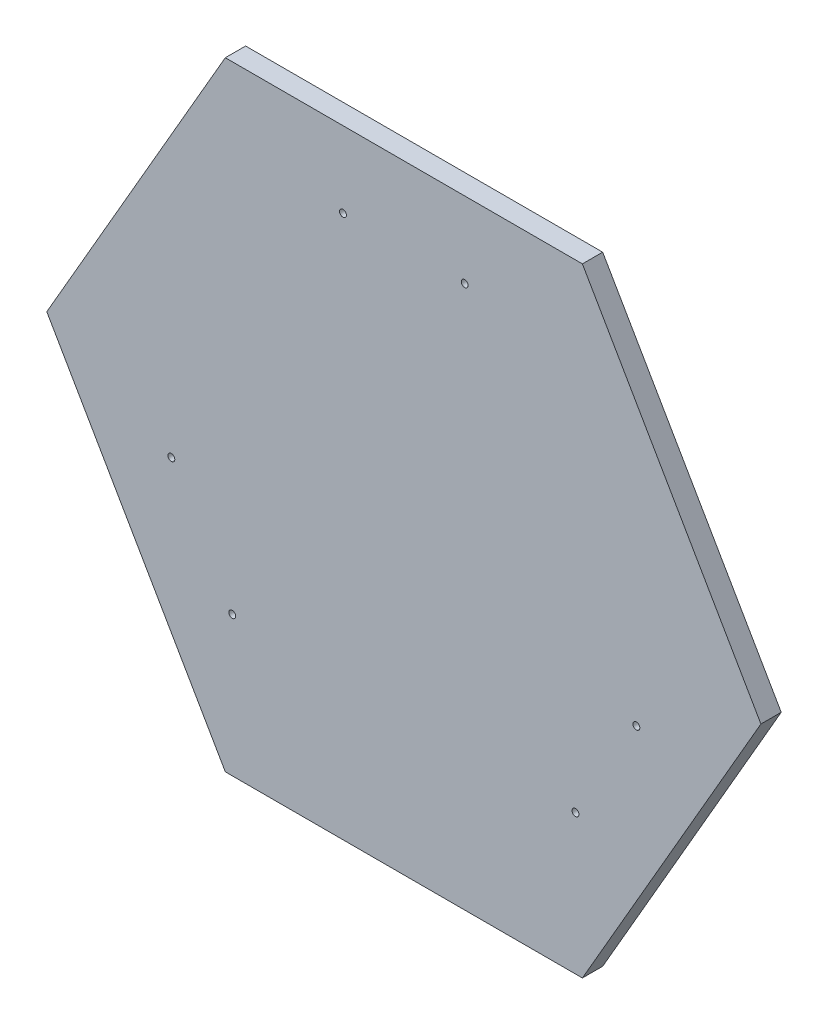
from build123d import *

# Parameters (mm, degrees)
BOSS_EXTRUDE1_DEPTH  = 5
M3_CLEARANCE_HOLE1_D = 3.4
CIRPATTERN1_COUNT    = 3


with BuildPart() as part:
    # Sketch2 → Boss-Extrude1 (new, symmetric)
    with BuildSketch(Plane.XY):
        Polygon((-87.988181024, 152.4), (-175.976362049, 0), (-87.988181024, -152.4), (87.988181024, -152.4), (175.976362049, 0), (87.988181024, 152.4), align=None)
    extrude(amount=BOSS_EXTRUDE1_DEPTH, both=True)

    # M3 Clearance Hole1 (through all)
    with Locations(Plane.XY.offset(5)):
        with Locations((-30.000000001, 115), (30.000000001, 115)):
            m3_clearance_hole1 = Hole(M3_CLEARANCE_HOLE1_D / 2)

    # CirPattern1: M3 Clearance Hole1 ×3 about axis
    cirpattern1_axis = Axis((0, 0, -20.250000596), (0, 0, 1))
    for i in range(1, CIRPATTERN1_COUNT):
        add(m3_clearance_hole1.rotate(cirpattern1_axis, i * 360 / CIRPATTERN1_COUNT), mode=Mode.SUBTRACT)


solid = part.part
